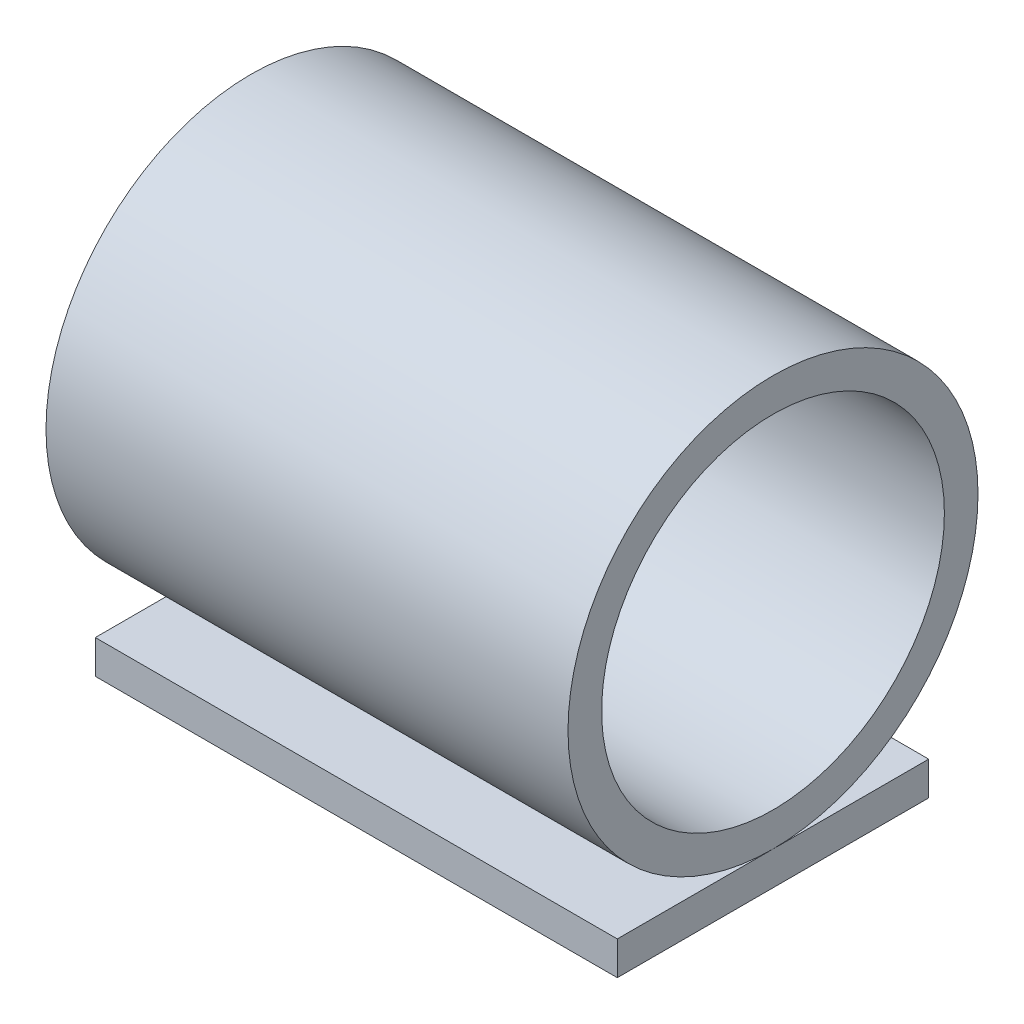
from build123d import *

# Parameters (mm, degrees)
SKETCH1_W           = 46.6
SKETCH1_H           = 27.8
BOSS_EXTRUDE1_DEPTH = 3
SKETCH3_R           = 18.3
BOSS_EXTRUDE2_DEPTH = 46.6
SKETCH4_R           = 15.3
CUT_EXTRUDE1_DEPTH  = 46.6


with BuildPart() as part:
    # Sketch1 → Boss-Extrude1 (new body)
    with BuildSketch(Plane(origin=(0, 0, 0), x_dir=(1, 0, 0), z_dir=(0, 1, 0))):
        with Locations((-23.300002726, -6.551e-06)):
            Rectangle(SKETCH1_W, SKETCH1_H)
    extrude(amount=BOSS_EXTRUDE1_DEPTH)


with BuildPart() as body_2:
    # Sketch3 → Boss-Extrude2 (new body)
    with BuildSketch(Plane(origin=(0, 0, 0), x_dir=(0, 0, -1), z_dir=(1, 0, 0))):
        with Locations((-6.551e-06, 21.3)):
            Circle(SKETCH3_R)
    extrude(amount=-BOSS_EXTRUDE2_DEPTH)

    # Sketch4 → Cut-Extrude1 (cut)
    with BuildSketch(Plane(origin=(0, 0, 0), x_dir=(0, 0, -1), z_dir=(1, 0, 0))):
        with Locations((0, 21.31516417)):
            Circle(SKETCH4_R)
    extrude(amount=-CUT_EXTRUDE1_DEPTH, mode=Mode.SUBTRACT)


solid = Compound([part.part, body_2.part])
